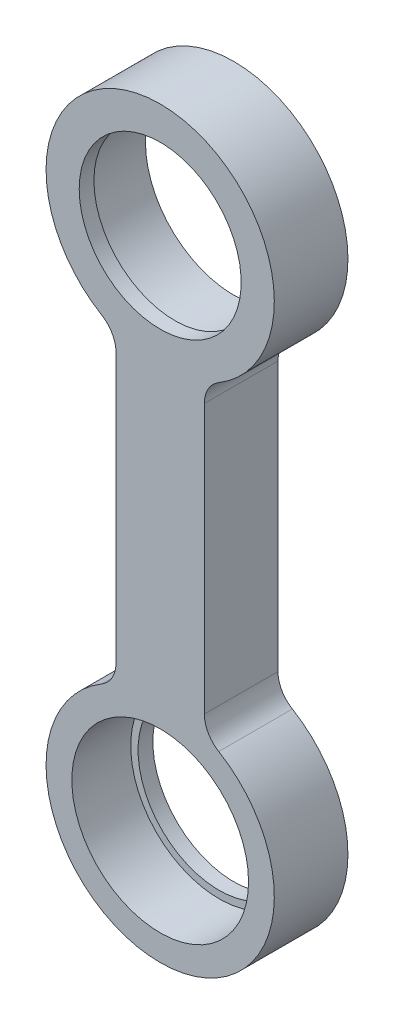
from build123d import *

# Parameters (mm, degrees)
EXTRUDE_1_DEPTH               = 5
HOLE_WIZARD_M10_1_D           = 11
HOLE_WIZARD_M10_1_CBORE_D     = 12
HOLE_WIZARD_M10_1_CBORE_DEPTH = 4
HOLE_WIZARD_M10_2_D           = 11
HOLE_WIZARD_M10_2_CBORE_D     = 12
HOLE_WIZARD_M10_2_CBORE_DEPTH = 4
FILLET_1_R                    = 2


with BuildPart() as part:
    # 草图1 → 凸台-拉伸1 (new body)
    with BuildSketch(Plane(origin=(0, 0, 0), x_dir=(-1, 0, 0), z_dir=(0, 0, -1))):
        with BuildLine():
            Line((-3, 27.854197036), (-3, 7.145802964))
            ThreePointArc((-3, 7.145802964), (0, -7.75), (3, 7.145802964))
            Line((3, 7.145802964), (3, 27.854197036))
            ThreePointArc((3, 27.854197036), (0, 42.75), (-3, 27.854197036))
        make_face()
    extrude(amount=-EXTRUDE_1_DEPTH)

    # M10 六角头螺栓的柱形沉头孔1 (through all)
    with Locations(Plane(origin=(0, 0, 0), x_dir=(-1, 0, 0), z_dir=(0, 0, -1))):
        with Locations((0, 35)):
            CounterBoreHole(HOLE_WIZARD_M10_1_D / 2, HOLE_WIZARD_M10_1_CBORE_D / 2, HOLE_WIZARD_M10_1_CBORE_DEPTH)

    # M10 六角头螺栓的柱形沉头孔2 (through all)
    with Locations(Plane.XY.offset(5)):
        with Locations((0, 0)):
            CounterBoreHole(HOLE_WIZARD_M10_2_D / 2, HOLE_WIZARD_M10_2_CBORE_D / 2, HOLE_WIZARD_M10_2_CBORE_DEPTH)

    # 圆角1
    fillet_1_edges = [part.edges().sort_by_distance(p)[0] for p in [
        (-3, 27.854197036, 2.5),
        (-3, 7.145802964, 2.5),
        (3, 7.145802964, 2.5),
        (3, 27.854197036, 2.5),
    ]]
    fillet(fillet_1_edges, radius=FILLET_1_R)


solid = part.part
